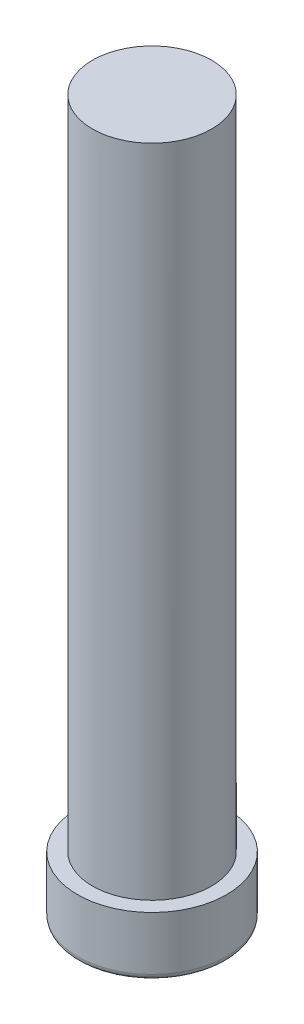
from build123d import *
from OCP.BRepFilletAPI import BRepFilletAPI_MakeChamfer

# Parameters (mm, degrees)
SKETCH1_R           = 25.4
BOSS_EXTRUDE1_DEPTH = 279.4
SKETCH2_R           = 31.75
BOSS_EXTRUDE2_DEPTH = 25.4
CUT_EXTRUDE1_DEPTH  = 12.7
FILLET1_R           = 2.54
CHAMFER1_SIZE       = 2.54
CHAMFER1_SIZE2      = 8.858032687


with BuildPart() as part:
    # Sketch1 → Boss-Extrude1 (new body)
    with BuildSketch(Plane(origin=(0, 0, 0), x_dir=(1, 0, 0), z_dir=(0, 1, 0))):
        with Locations(Location((0, 0, 0), (0, 0, 270))):
            Circle(SKETCH1_R)
    extrude(amount=BOSS_EXTRUDE1_DEPTH)

    # Sketch2 → Boss-Extrude2 (add)
    with BuildSketch(Plane.XZ):
        with Locations(Location((0, 0, 0), (0, 0, 270))):
            Circle(SKETCH2_R)
    extrude(amount=BOSS_EXTRUDE2_DEPTH)

    # Sketch3 → Cut-Extrude1 (cut)
    with BuildSketch(Plane.XZ.offset(25.4)):
        Polygon((25.303831814, 0), (17.892511066, 17.892511066), (0, 25.303831814), (-17.892511066, 17.892511066), (-25.303831814, 0), (-17.892511066, -17.892511066), (0, -25.303831814), (17.892511066, -17.892511066), align=None)
    extrude(amount=-CUT_EXTRUDE1_DEPTH, mode=Mode.SUBTRACT)

    # Fillet1
    fillet1_edges = [part.edges().sort_by_distance(p)[0] for p in [
        (0, -25.4, 31.75),
    ]]
    fillet(fillet1_edges, radius=FILLET1_R)

    # Chamfer1: one chamfer whose edges measure the first distance from different faces: ONE call of the kernel's chamfer builder (chamfer() names one face for all edges)
    chamfer1_edges_1 = [part.edges().sort_by_distance(p)[0] for p in [
        (8.946255533, -12.7, 21.59817144),
    ]]
    chamfer1_side_1 = [part.faces().sort_by_distance(p)[0] for p in [
        (8.946255533, -19.05, 21.59817144),
    ]]
    chamfer1_edges_2 = [part.edges().sort_by_distance(p)[0] for p in [
        (21.59817144, -12.7, 8.946255533),
    ]]
    chamfer1_side_2 = [part.faces().sort_by_distance(p)[0] for p in [
        (21.59817144, -19.05, 8.946255533),
    ]]
    chamfer1_edges_3 = [part.edges().sort_by_distance(p)[0] for p in [
        (21.59817144, -12.7, -8.946255533),
    ]]
    chamfer1_side_3 = [part.faces().sort_by_distance(p)[0] for p in [
        (21.59817144, -19.05, -8.946255533),
    ]]
    chamfer1_edges_4 = [part.edges().sort_by_distance(p)[0] for p in [
        (8.946255533, -12.7, -21.59817144),
    ]]
    chamfer1_side_4 = [part.faces().sort_by_distance(p)[0] for p in [
        (8.946255533, -19.05, -21.59817144),
    ]]
    chamfer1_edges_5 = [part.edges().sort_by_distance(p)[0] for p in [
        (-8.946255533, -12.7, -21.59817144),
    ]]
    chamfer1_side_5 = [part.faces().sort_by_distance(p)[0] for p in [
        (-8.946255533, -19.05, -21.59817144),
    ]]
    chamfer1_edges_6 = [part.edges().sort_by_distance(p)[0] for p in [
        (-21.59817144, -12.7, -8.946255533),
    ]]
    chamfer1_side_6 = [part.faces().sort_by_distance(p)[0] for p in [
        (-21.59817144, -19.05, -8.946255533),
    ]]
    chamfer1_edges_7 = [part.edges().sort_by_distance(p)[0] for p in [
        (-21.59817144, -12.7, 8.946255533),
    ]]
    chamfer1_side_7 = [part.faces().sort_by_distance(p)[0] for p in [
        (-21.59817144, -19.05, 8.946255533),
    ]]
    chamfer1_edges_8 = [part.edges().sort_by_distance(p)[0] for p in [
        (-8.946255533, -12.7, 21.59817144),
    ]]
    chamfer1_side_8 = [part.faces().sort_by_distance(p)[0] for p in [
        (-8.946255533, -19.05, 21.59817144),
    ]]
    chamfer1 = BRepFilletAPI_MakeChamfer(part.part.solid().wrapped)
    for e in chamfer1_edges_1:
        chamfer1.Add(CHAMFER1_SIZE, CHAMFER1_SIZE2, e.wrapped, chamfer1_side_1[0].wrapped)  # the first distance lies on this face
    for e in chamfer1_edges_2:
        chamfer1.Add(CHAMFER1_SIZE, CHAMFER1_SIZE2, e.wrapped, chamfer1_side_2[0].wrapped)  # the first distance lies on this face
    for e in chamfer1_edges_3:
        chamfer1.Add(CHAMFER1_SIZE, CHAMFER1_SIZE2, e.wrapped, chamfer1_side_3[0].wrapped)  # the first distance lies on this face
    for e in chamfer1_edges_4:
        chamfer1.Add(CHAMFER1_SIZE, CHAMFER1_SIZE2, e.wrapped, chamfer1_side_4[0].wrapped)  # the first distance lies on this face
    for e in chamfer1_edges_5:
        chamfer1.Add(CHAMFER1_SIZE, CHAMFER1_SIZE2, e.wrapped, chamfer1_side_5[0].wrapped)  # the first distance lies on this face
    for e in chamfer1_edges_6:
        chamfer1.Add(CHAMFER1_SIZE, CHAMFER1_SIZE2, e.wrapped, chamfer1_side_6[0].wrapped)  # the first distance lies on this face
    for e in chamfer1_edges_7:
        chamfer1.Add(CHAMFER1_SIZE, CHAMFER1_SIZE2, e.wrapped, chamfer1_side_7[0].wrapped)  # the first distance lies on this face
    for e in chamfer1_edges_8:
        chamfer1.Add(CHAMFER1_SIZE, CHAMFER1_SIZE2, e.wrapped, chamfer1_side_8[0].wrapped)  # the first distance lies on this face
    add(Compound.cast(chamfer1.Shape()), mode=Mode.REPLACE)


solid = part.part
